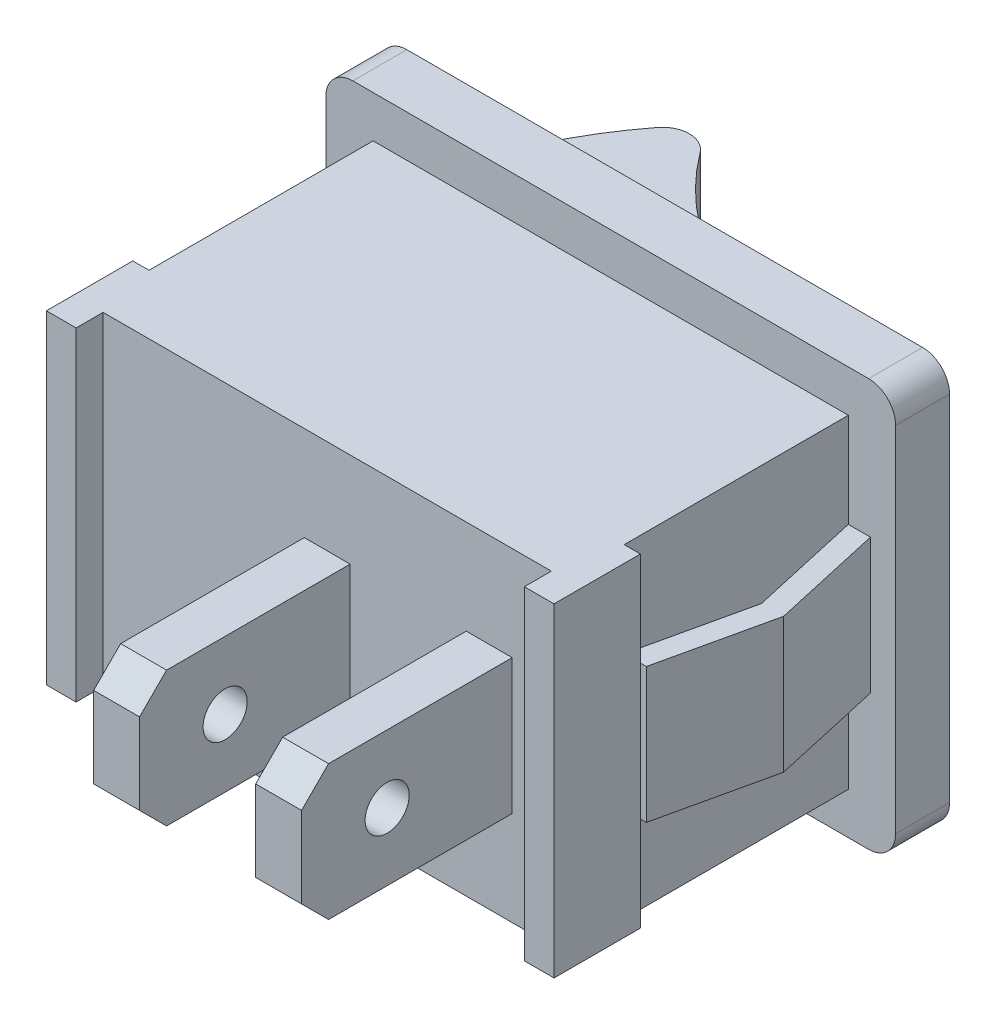
from build123d import *

# Parameters (mm, degrees)
BOSS_EXTRUDE1_DEPTH = 6
SKETCH2_W           = 21.1
SKETCH2_H           = 15.1
BOSS_EXTRUDE2_DEPTH = 2
FILLET1_R           = 1
SKETCH3_R           = 0.816975511
BOSS_EXTRUDE3_DEPTH = 0.85
LPATTERN1_COUNT     = 2
LPATTERN1_PITCH     = 6
BOSS_EXTRUDE4_DEPTH = 4.75
BOSS_EXTRUDE5_DEPTH = 2.5


with BuildPart() as part:
    # Sketch1 → Boss-Extrude1 (new, symmetric)
    with BuildSketch(Plane(origin=(0, 0, 0), x_dir=(1, 0, 0), z_dir=(0, 1, 0))):
        Polygon((-8.3, 0), (8.3, 0), (8.3, -1), (9.4, -1), (9.4, 2.2), (8.8, 2.2), (8.8, 10.5), (-8.8, 10.5), (-8.8, 2.2), (-9.4, 2.2), (-9.4, -1), (-8.3, -1), align=None)
    extrude(amount=BOSS_EXTRUDE1_DEPTH, both=True)

    # Sketch2 → Boss-Extrude2 (add)
    with BuildSketch(Plane(origin=(0, 0, -10.5), x_dir=(-1, 0, 0), z_dir=(0, 0, -1))):
        Rectangle(SKETCH2_W, SKETCH2_H)
    extrude(amount=BOSS_EXTRUDE2_DEPTH)

    # Fillet1
    fillet1_edges = [part.edges().sort_by_distance(p)[0] for p in [
        (10.55, 7.55, -11.5),
        (10.55, -7.55, -11.5),
        (-10.55, -7.55, -11.5),
        (-10.55, 7.55, -11.5),
    ]]
    fillet(fillet1_edges, radius=FILLET1_R)

    # Sketch3 → Boss-Extrude3 (add, symmetric)
    with BuildSketch(Plane(origin=(0, 0, 0), x_dir=(0, 0, -1), z_dir=(1, 0, 0))):
        Polygon((0, 2.5), (-6.8, 2.5), (-7.8, 1.5), (-7.8, -1.5), (-6.8, -2.5), (0, -2.5), align=None)
        with Locations((-4.630991461, 0)):
            Circle(SKETCH3_R, mode=Mode.SUBTRACT)
    boss_extrude3 = extrude(amount=BOSS_EXTRUDE3_DEPTH, both=True)

    # LPattern1: Boss-Extrude3 ×2
    with Locations(*[(i * LPATTERN1_PITCH, 0, 0) for i in range(1, LPATTERN1_COUNT)]):
        add(boss_extrude3)

    # Sketch4 → Boss-Extrude4 (add, symmetric)
    with BuildSketch(Plane(origin=(0, 0, 0), x_dir=(1, 0, 0), z_dir=(0, 1, 0))):
        with BuildLine():
            Line((7.176954922, 12.800602649), (7.176954922, 12.5))
            Line((7.176954922, 12.5), (-7.71090433, 12.5))
            ThreePointArc((-7.71090433, 12.5), (-6.700290902, 15.093362546), (-5.21395506, 17.446588959))
            ThreePointArc((-5.21395506, 17.446588959), (-4.414402061, 17.834047388), (-3.622018998, 17.432129346))
            ThreePointArc((-3.622018998, 17.432129346), (1.155737297, 13.666724512), (7.176954922, 12.800602649))
        make_face()
    extrude(amount=BOSS_EXTRUDE4_DEPTH, both=True)

    # Sketch5 → Boss-Extrude5 (add, symmetric)
    with BuildSketch(Plane(origin=(0, 0, 0), x_dir=(1, 0, 0), z_dir=(0, 1, 0))):
        Polygon((8.8, 10.5), (9.730151973, 6.35), (8.8, 2.2), (9.619848027, 2.2), (10.55, 6.35), (9.619848027, 10.5), align=None)
    boss_extrude5 = extrude(amount=BOSS_EXTRUDE5_DEPTH, both=True)

    # Mirror1: Boss-Extrude5 across plane
    add(boss_extrude5.mirror(Plane(origin=(0, 0, 0), x_dir=(0, 0, 1), z_dir=(1, 0, 0))))


solid = part.part
